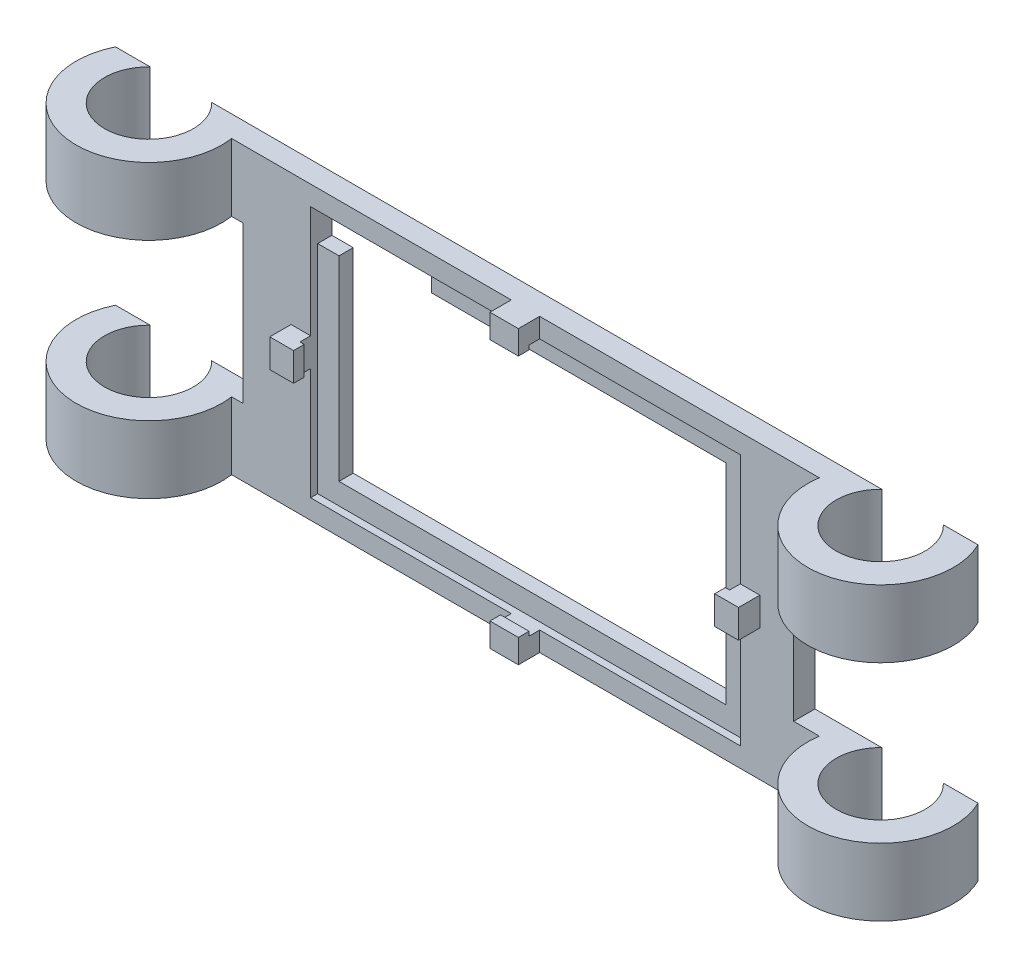
from build123d import *

# Parameters (mm, degrees)
BOSS_EXTRUDE1_DEPTH = 20.5
SKETCH2_W           = 11
SKETCH2_H           = 11
CUT_EXTRUDE1_DEPTH  = 38.791732231
SKETCH3_W           = 30.25
SKETCH3_H           = 17.75
CUT_EXTRUDE2_DEPTH  = 0.5
CUT_EXTRUDE3_REACH  = 39.609
SKETCH4_W           = 27.25
SKETCH4_H           = 14.75
SKETCH5_W           = 2
SKETCH5_H           = 1.375
SKETCH5_W_2         = 1.375
SKETCH5_H_2         = 2
BOSS_EXTRUDE2_DEPTH = 0.75
SKETCH6_W           = 1.375
SKETCH6_H           = 2
SKETCH6_W_2         = 0.3
SKETCH6_W_3         = 2
SKETCH6_H_2         = 0.3
SKETCH6_H_3         = 1.375
BOSS_EXTRUDE3_DEPTH = 0.75
SKETCH7_W           = 8
SKETCH7_H           = 2.5
CUT_EXTRUDE4_DEPTH  = 38.609374164
CUT_EXTRUDE5_REACH  = 39.528
SKETCH8_W           = 1
SKETCH8_H           = 11


with BuildPart() as part:
    # Sketch1 → Boss-Extrude1 (new body)
    with BuildSketch(Plane(origin=(0, 0, 0), x_dir=(1, 0, 0), z_dir=(0, 1, 0))):
        with BuildLine():
            Line((-21.150314886, 2.25), (-22.947265174, 1.37195122))
            ThreePointArc((-22.947265174, 1.37195122), (-22.710349254, 0.704078714), (-22.63, 0))
            ThreePointArc((-22.63, 0), (-26.459078714, -3.044650746), (-28.562734826, 1.37195122))
            Line((-28.562734826, 1.37195122), (-30.359685114, 2.25))
            ThreePointArc((-30.359685114, 2.25), (-26.90968909, -4.993227223), (-20.63, 0))
            ThreePointArc((-20.63, 0), (-20.643812376, 0.376013393), (-20.685175052, 0.75))
            ThreePointArc((-20.685175052, 0.75), (-20.85994778, 1.517922517), (-21.150314886, 2.25))
        make_face()
        with BuildLine():
            Line((21.150314886, 2.25), (-21.150314886, 2.25))
            ThreePointArc((-21.150314886, 2.25), (-20.85994778, 1.517922517), (-20.685175052, 0.75))
            Line((-20.685175052, 0.75), (20.685175052, 0.75))
            ThreePointArc((20.685175052, 0.75), (20.85994778, 1.517922517), (21.150314886, 2.25))
        make_face()
        with BuildLine():
            Line((22.947265174, 1.37195122), (21.150314886, 2.25))
            ThreePointArc((21.150314886, 2.25), (20.85994778, 1.517922517), (20.685175052, 0.75))
            ThreePointArc((20.685175052, 0.75), (25.378986607, -5.111187624), (30.88, 0))
            ThreePointArc((30.88, 0), (30.748227223, 1.15468909), (30.359685114, 2.25))
            Line((30.359685114, 2.25), (28.562734826, 1.37195122))
            ThreePointArc((28.562734826, 1.37195122), (28.799650746, 0.704078714), (28.88, 0))
            ThreePointArc((28.88, 0), (25.050921286, -3.044650746), (22.947265174, 1.37195122))
        make_face()
        with BuildLine():
            Line((23.586331053, 2.25), (21.150314886, 2.25))
            Line((21.150314886, 2.25), (22.947265174, 1.37195122))
            ThreePointArc((22.947265174, 1.37195122), (23.22836369, 1.838949145), (23.586331053, 2.25))
        make_face()
        with BuildLine():
            Line((28.562734826, 1.37195122), (30.359685114, 2.25))
            Line((30.359685114, 2.25), (27.923668947, 2.25))
            ThreePointArc((27.923668947, 2.25), (28.28163631, 1.838949145), (28.562734826, 1.37195122))
        make_face()
        with BuildLine():
            ThreePointArc((-23.586331053, 2.25), (-23.22836369, 1.838949145), (-22.947265174, 1.37195122))
            Line((-22.947265174, 1.37195122), (-21.150314886, 2.25))
            Line((-21.150314886, 2.25), (-23.586331053, 2.25))
        make_face()
        with BuildLine():
            Line((-30.359685114, 2.25), (-28.562734826, 1.37195122))
            ThreePointArc((-28.562734826, 1.37195122), (-28.28163631, 1.838949145), (-27.923668947, 2.25))
            Line((-27.923668947, 2.25), (-30.359685114, 2.25))
        make_face()
    extrude(amount=BOSS_EXTRUDE1_DEPTH)

    # Sketch2 → Cut-Extrude1 (cut, through all)
    with BuildSketch(Plane(origin=(0, 0, -2.25), x_dir=(-1, 0, 0), z_dir=(0, 0, -1))):
        with Locations((-25.38, 10.25)):
            Rectangle(SKETCH2_W, SKETCH2_H)
        with Locations((25.38, 10.25)):
            Rectangle(SKETCH2_W, SKETCH2_H)
    extrude(amount=-CUT_EXTRUDE1_DEPTH, mode=Mode.SUBTRACT)

    # Sketch3 → Cut-Extrude2 (cut)
    with BuildSketch(Plane.XY.offset(-0.75)):
        with Locations((0, 10.25)):
            Rectangle(SKETCH3_W, SKETCH3_H)
    extrude(amount=-CUT_EXTRUDE2_DEPTH, mode=Mode.SUBTRACT)

    # Sketch4 → Cut-Extrude3 (cut, up to next)
    with BuildSketch(Plane.XY.offset(-1.25), mode=Mode.PRIVATE) as cut_extrude3_sk1:
        with Locations((0, 10.25)):
            Rectangle(SKETCH4_W, SKETCH4_H)
    cut_extrude3_tool1 = extrude(cut_extrude3_sk1.sketch, amount=-CUT_EXTRUDE3_REACH, mode=Mode.PRIVATE) & part.part
    add(cut_extrude3_tool1.solids().sort_by_distance((0, 10.25, -1.25))[0], mode=Mode.SUBTRACT)

    # Sketch5 → Boss-Extrude2 (add)
    with BuildSketch(Plane.XY.offset(-0.75)):
        with Locations((0, 19.8125)):
            Rectangle(SKETCH5_W, SKETCH5_H)
        with Locations((0, 0.6875)):
            Rectangle(SKETCH5_W, SKETCH5_H)
        with Locations((-15.8125, 10.25)):
            Rectangle(SKETCH5_W_2, SKETCH5_H_2)
        with Locations((15.8125, 10.25)):
            Rectangle(SKETCH5_W_2, SKETCH5_H_2)
    extrude(amount=BOSS_EXTRUDE2_DEPTH)

    # Sketch6 → Boss-Extrude3 (add)
    with BuildSketch(Plane.XY):
        with Locations((-15.8125, 10.25)):
            Rectangle(SKETCH6_W, SKETCH6_H)
        with Locations((-14.975, 10.25)):
            Rectangle(SKETCH6_W_2, SKETCH6_H)
        with Locations((0, 1.525)):
            Rectangle(SKETCH6_W_3, SKETCH6_H_2)
        with Locations((0, 0.6875)):
            Rectangle(SKETCH6_W_3, SKETCH6_H_3)
        with Locations((14.975, 10.25)):
            Rectangle(SKETCH6_W_2, SKETCH6_H)
        with Locations((15.8125, 10.25)):
            Rectangle(SKETCH6_W, SKETCH6_H)
        with Locations((0, 19.8125)):
            Rectangle(SKETCH6_W_3, SKETCH6_H_3)
        with Locations((0, 18.975)):
            Rectangle(SKETCH6_W_3, SKETCH6_H_2)
    extrude(amount=BOSS_EXTRUDE3_DEPTH)

    # Sketch7 → Cut-Extrude4 (cut, through all)
    with BuildSketch(Plane.XY.offset(-1.25)):
        with Locations((-11.125, 17.875)):
            Rectangle(SKETCH7_W, SKETCH7_H)
    extrude(amount=-CUT_EXTRUDE4_DEPTH, mode=Mode.SUBTRACT)

    # Sketch8 → Cut-Extrude5 (cut, up to next)
    with BuildSketch(Plane.XY.offset(-0.75), mode=Mode.PRIVATE) as cut_extrude5_sk1:
        with Locations((19.38, 10.25)):
            Rectangle(SKETCH8_W, SKETCH8_H)
    cut_extrude5_tool1 = extrude(cut_extrude5_sk1.sketch, amount=-CUT_EXTRUDE5_REACH, mode=Mode.PRIVATE) & part.part
    add(cut_extrude5_tool1.solids().sort_by_distance((19.38, 10.25, -0.75))[0], mode=Mode.SUBTRACT)


solid = part.part
